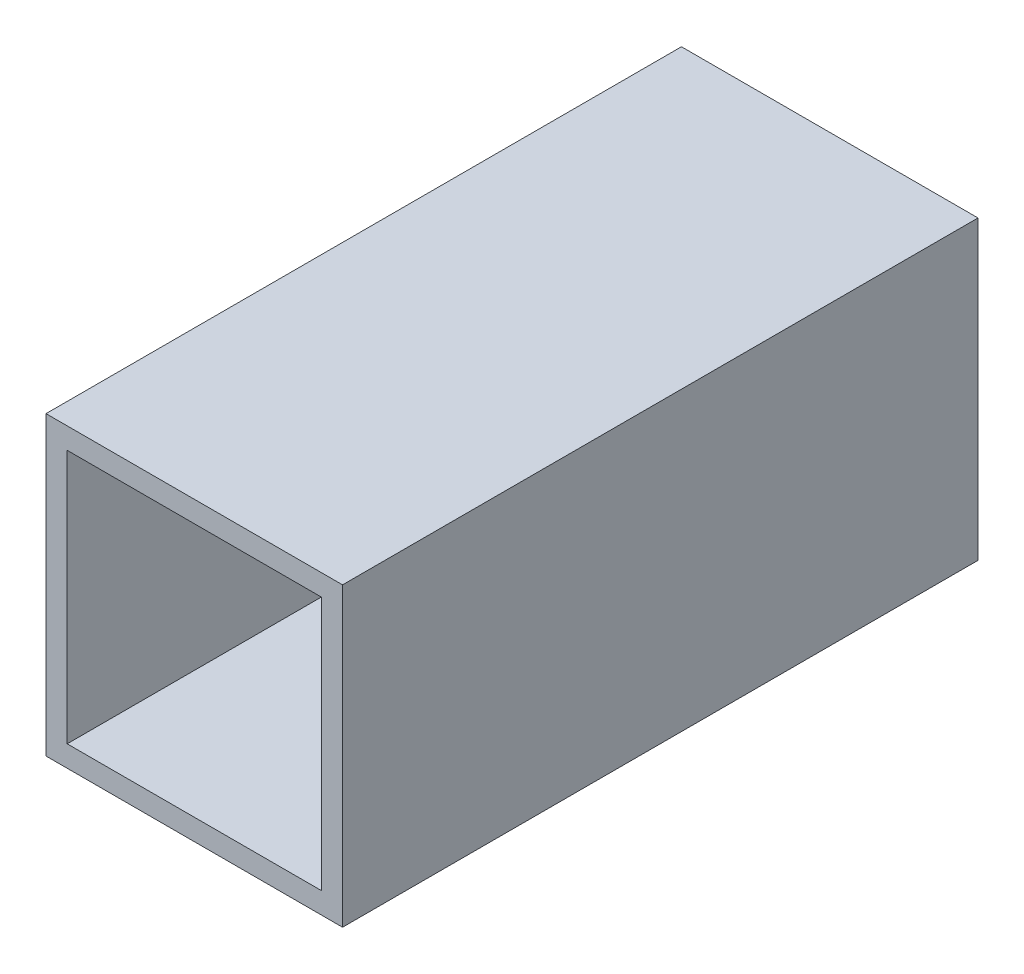
from build123d import *

# Parameters (mm, degrees)
SKETCH2_W           = 44.45
SKETCH2_H           = 44.45
SKETCH2_W_2         = 38.1
SKETCH2_H_2         = 38.1
BOSS_EXTRUDE1_DEPTH = 95.25


with BuildPart() as part:
    # Sketch2 → Boss-Extrude1 (new body)
    with BuildSketch(Plane.XY):
        Rectangle(SKETCH2_W, SKETCH2_H)
        Rectangle(SKETCH2_W_2, SKETCH2_H_2, mode=Mode.SUBTRACT)
    extrude(amount=BOSS_EXTRUDE1_DEPTH)


solid = part.part
